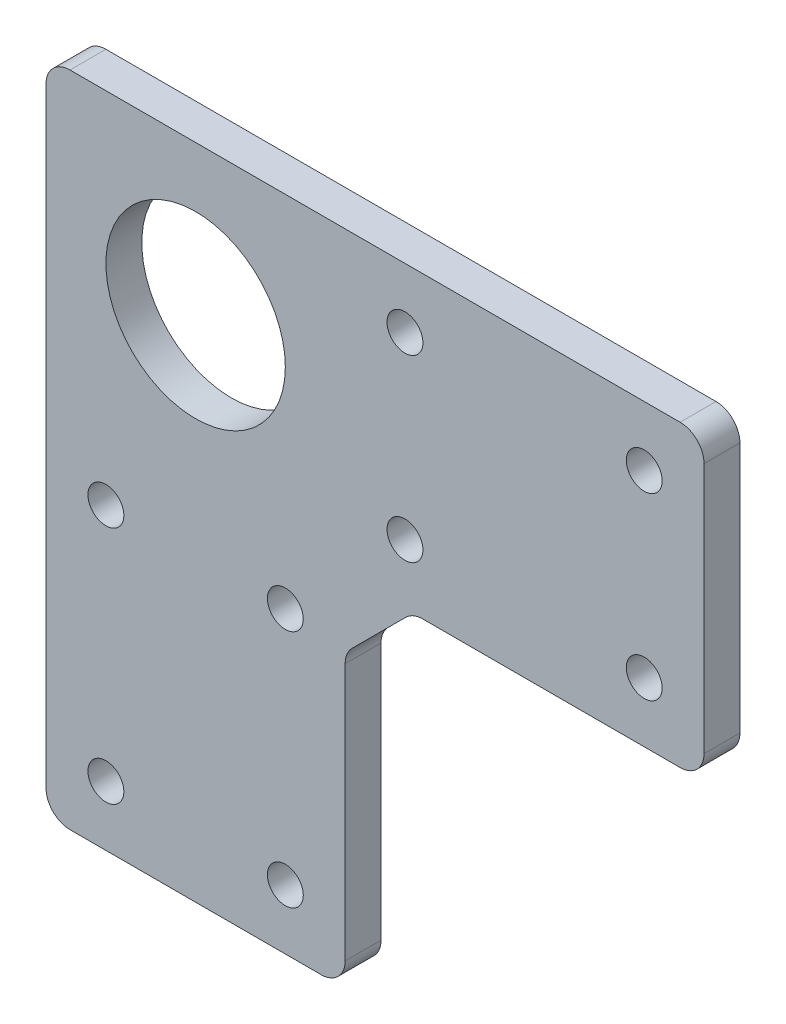
from build123d import *

# Parameters (mm, degrees)
SKETCH_1_W          = 25
SKETCH_1_H          = 30
EXTRUDE_1_DEPTH     = 1.5
SKETCH_2_R          = 1.5
CUT_EXTRUDE_1_DEPTH = 21.5
EXTRUDE_2_DEPTH     = 3
FILLET_1_R          = 2
SKETCH_4_R          = 7.5
CUT_EXTRUDE_2_DEPTH = 10


with BuildPart() as part:
    # 草图1 → 凸台-拉伸1 (new, symmetric)
    with BuildSketch(Plane.XY):
        with Locations((12.5, -15)):
            Rectangle(SKETCH_1_W, SKETCH_1_H)
        Polygon((0, 25), (0, 0), (25, 0), (55, 0), (55, 25), align=None)
    extrude(amount=EXTRUDE_1_DEPTH, both=True)

    # 草图2 → 切除-拉伸1 (cut, symmetric)
    with BuildSketch(Plane.XY.offset(1.5)):
        with Locations((20, -25)):
            Circle(SKETCH_2_R)
        with Locations((5, -25)):
            Circle(SKETCH_2_R)
        with Locations((5, -5)):
            Circle(SKETCH_2_R)
        with Locations((20, -5)):
            Circle(SKETCH_2_R)
        with Locations((30, 5)):
            Circle(SKETCH_2_R)
        with Locations((30, 20)):
            Circle(SKETCH_2_R)
        with Locations((50, 20)):
            Circle(SKETCH_2_R)
        with Locations((50, 5)):
            Circle(SKETCH_2_R)
    extrude(amount=CUT_EXTRUDE_1_DEPTH, both=True, mode=Mode.SUBTRACT)

    # 草图3 → 凸台-拉伸2 (add)
    with BuildSketch(Plane.XY.offset(1.5)):
        Polygon((25, -5.656854249), (30.656854249, 0), (25, 0), align=None)
    extrude(amount=-EXTRUDE_2_DEPTH)

    # 圆角1
    fillet_1_edges = [part.edges().sort_by_distance(p)[0] for p in [
        (25, -30, 0),
        (0, -30, 0),
        (0, 25, 0),
        (55, 25, 0),
        (55, 0, 0),
        (25, -5.656854249, 0),
        (30.656854249, 0, 0),
    ]]
    fillet(fillet_1_edges, radius=FILLET_1_R)

    # 草图4 → 切除-拉伸2 (cut)
    with BuildSketch(Plane.XY.offset(1.5)):
        with Locations((12.5, 12.5)):
            Circle(SKETCH_4_R)
    extrude(amount=-CUT_EXTRUDE_2_DEPTH, mode=Mode.SUBTRACT)


solid = part.part
